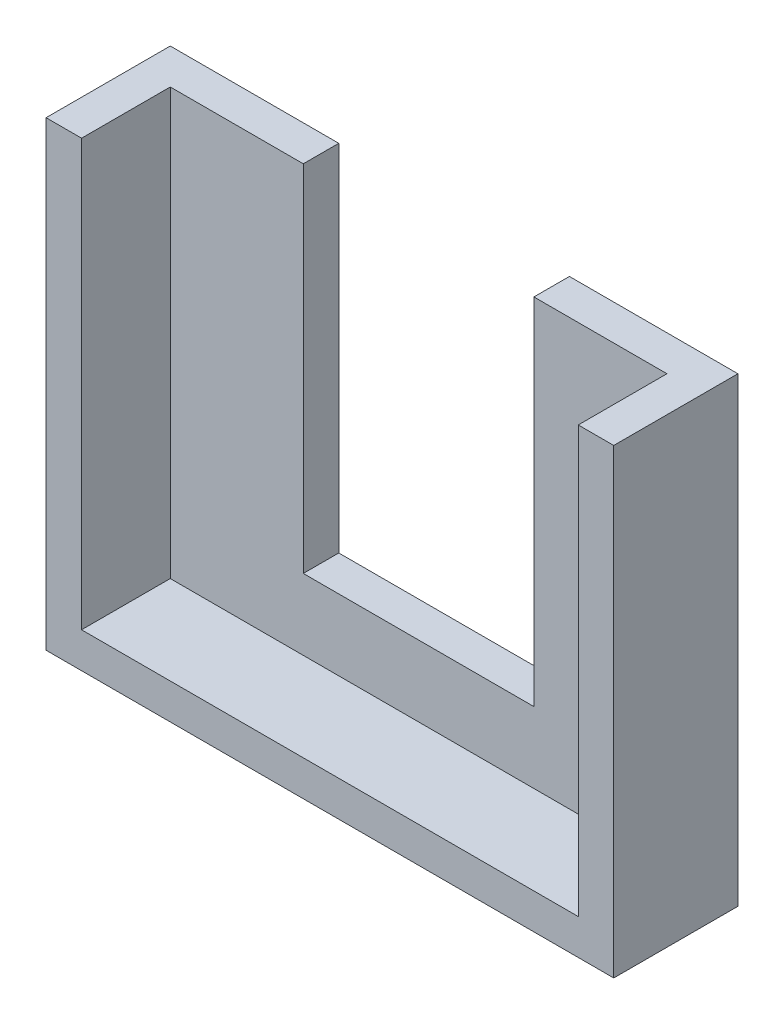
from build123d import *

# Parameters (mm, degrees)
SKETCH_1_W          = 160
SKETCH_1_H          = 130
EXTRUDE_1_DEPTH     = 10
CUT_EXTRUDE_1_DEPTH = 10
EXTRUDE_2_DEPTH     = 25


with BuildPart() as part:
    # 草图1 → 凸台-拉伸1 (new body)
    with BuildSketch(Plane.XY):
        Rectangle(SKETCH_1_W, SKETCH_1_H)
    extrude(amount=EXTRUDE_1_DEPTH)

    # 草图2 → 切除-拉伸1 (cut)
    with BuildSketch(Plane.XY.offset(10)):
        Polygon((-32.5, 35), (-32.5, 65), (32.5, 65), (32.5, 35), (32.5, -35), (-32.5, -35), align=None)
    extrude(amount=-CUT_EXTRUDE_1_DEPTH, mode=Mode.SUBTRACT)

    # 草图3 → 凸台-拉伸2 (add)
    with BuildSketch(Plane.XY.offset(10)):
        Polygon((-70, 65), (-70, -55), (70, -55), (70, 65), (80, 65), (80, -65), (-80, -65), (-80, 65), align=None)
    extrude(amount=EXTRUDE_2_DEPTH)


solid = part.part
